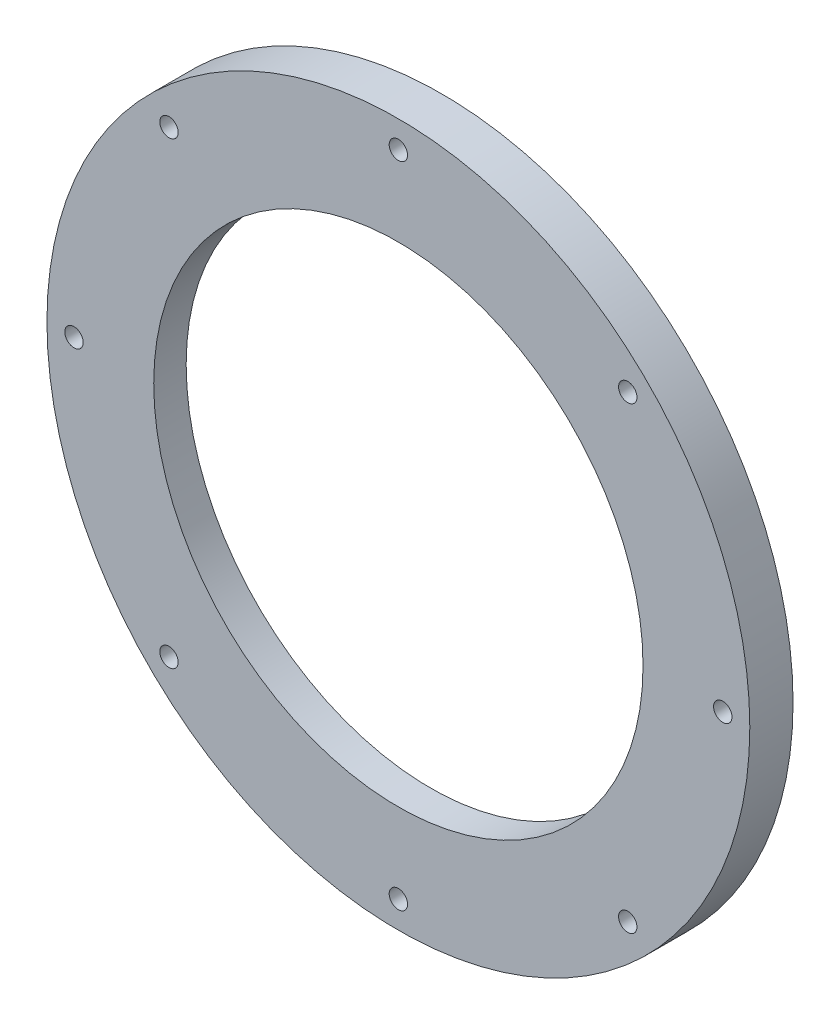
from build123d import *

# Parameters (mm, degrees)
CROQUIS1_R                   = 65
CROQUIS1_R_2                 = 45.25
SALIENTE_EXTRUIR1_DEPTH      = 4
TALADRO_DE_MARGEN_PARA_M31_D = 3.4
CROQUIS4_R                   = 50
CORTAR_EXTRUIR1_DEPTH        = 2


with BuildPart() as part:
    # Croquis1 → Saliente-Extruir1 (new, symmetric)
    with BuildSketch(Plane.XY):
        Circle(CROQUIS1_R)
        Circle(CROQUIS1_R_2, mode=Mode.SUBTRACT)
    extrude(amount=SALIENTE_EXTRUIR1_DEPTH, both=True)

    # Taladro de margen para M31 (through all)
    with Locations(Plane.XY.offset(4)):
        with Locations((0, 60), (42.426406871, 42.426406871), (60, 0), (42.426406871, -42.426406871), (0, -60), (-42.426406871, -42.426406871), (-60, 0), (-42.426406871, 42.426406871)):
            Hole(TALADRO_DE_MARGEN_PARA_M31_D / 2)

    # Croquis4 → Cortar-Extruir1 (cut)
    with BuildSketch(Plane(origin=(0, 0, -4), x_dir=(-1, 0, 0), z_dir=(0, 0, -1))):
        Circle(CROQUIS4_R)
    extrude(amount=-CORTAR_EXTRUIR1_DEPTH, mode=Mode.SUBTRACT)


solid = part.part
